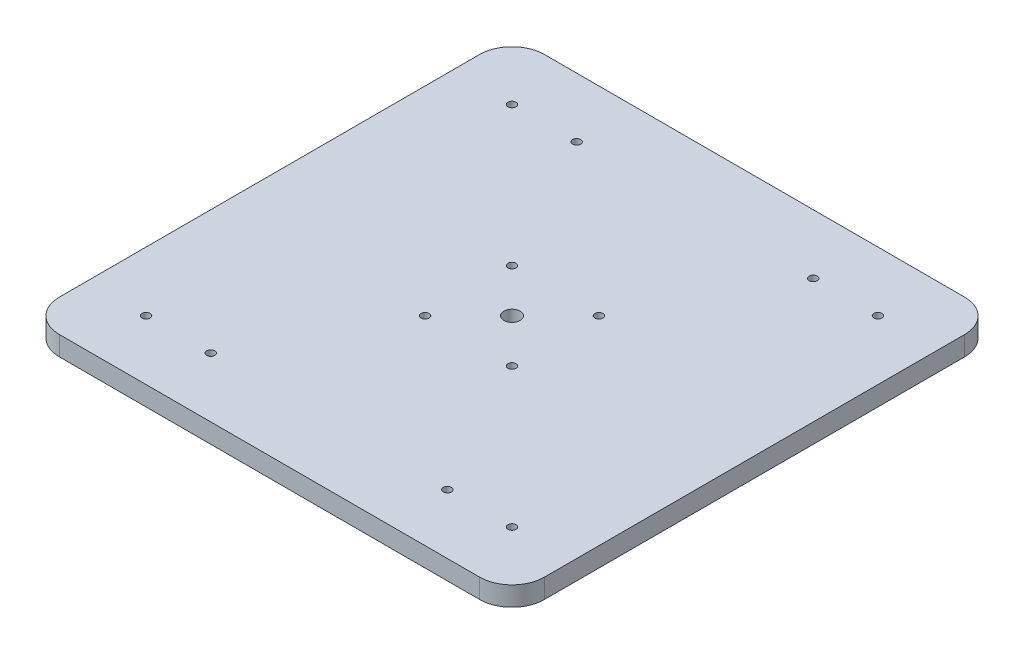
from build123d import *

# Parameters (mm, degrees)
SKETCH_1_W               = 150
SKETCH_1_H               = 150
EXTRUDE_1_DEPTH          = 6
FILLET_1_R               = 10
SKETCH_3_R               = 1.25
CUT_EXTRUDE_4_DEPTH      = 107.235587258
PATTERN_CIRCULAR_2_COUNT = 4
SKETCH_7_R               = 1.25
CUT_EXTRUDE_11_DEPTH     = 10
SKETCH_9_R               = 1.25
CUT_EXTRUDE_12_DEPTH     = 10
SKETCH_10_R              = 2.5
CUT_EXTRUDE_13_DEPTH     = 10


with BuildPart() as part:
    # 草图1 → 凸台-拉伸1 (new body)
    with BuildSketch(Plane(origin=(0, 0, 0), x_dir=(1, 0, 0), z_dir=(0, 1, 0))):
        Rectangle(SKETCH_1_W, SKETCH_1_H)
    extrude(amount=EXTRUDE_1_DEPTH)

    # 圆角1
    fillet_1_edges = [part.edges().sort_by_distance(p)[0] for p in [
        (75, 3, 75),
        (-75, 3, 75),
        (-75, 3, -75),
        (75, 3, -75),
    ]]
    fillet(fillet_1_edges, radius=FILLET_1_R)

    # 草图3 → 切除-拉伸4 (cut, through all)
    with BuildSketch(Plane.XZ):
        with Locations(Location((56.568542495, 56.568542495, 0), (0, 0, 270))):
            Circle(SKETCH_3_R)
    cut_extrude_4 = extrude(amount=-CUT_EXTRUDE_4_DEPTH, mode=Mode.SUBTRACT)

    # 阵列(圆周)2: 切除-拉伸4 ×4 about axis
    pattern_circular_2_axis = Axis((-0.01239132, 0, -0.01239132), (0, 1, 0))
    for i in range(1, PATTERN_CIRCULAR_2_COUNT):
        add(cut_extrude_4.rotate(pattern_circular_2_axis, i * 360 / PATTERN_CIRCULAR_2_COUNT), mode=Mode.SUBTRACT)

    # 草图7 → 切除-拉伸11 (cut)
    with BuildSketch(Plane.XZ):
        with Locations(Location((-36.593325134, -56.593325134, 0), (0, 0, 270))):
            Circle(SKETCH_7_R)
        with Locations(Location((36.568542495, -56.593325134, 0), (0, 0, 270))):
            Circle(SKETCH_7_R)
        with Locations(Location((-36.593325134, 56.568542495, 0), (0, 0, 270))):
            Circle(SKETCH_7_R)
        with Locations(Location((36.568542495, 56.568542495, 0), (0, 0, 270))):
            Circle(SKETCH_7_R)
    extrude(amount=-CUT_EXTRUDE_11_DEPTH, mode=Mode.SUBTRACT)

    # 草图9 → 切除-拉伸12 (cut)
    with BuildSketch(Plane.XZ):
        with Locations(Location((13.435028843, 13.435028843, 0), (0, 0, 270))):
            Circle(SKETCH_9_R)
        with Locations(Location((13.435028843, -13.435028843, 0), (0, 0, 270))):
            Circle(SKETCH_9_R)
        with Locations(Location((-13.435028843, -13.435028843, 0), (0, 0, 270))):
            Circle(SKETCH_9_R)
        with Locations(Location((-13.435028843, 13.435028843, 0), (0, 0, 270))):
            Circle(SKETCH_9_R)
    extrude(amount=-CUT_EXTRUDE_12_DEPTH, mode=Mode.SUBTRACT)

    # 草图10 → 切除-拉伸13 (cut)
    with BuildSketch(Plane.XZ):
        with Locations(Location((0, 0, 0), (0, 0, 270))):
            Circle(SKETCH_10_R)
    extrude(amount=-CUT_EXTRUDE_13_DEPTH, mode=Mode.SUBTRACT)


solid = part.part
